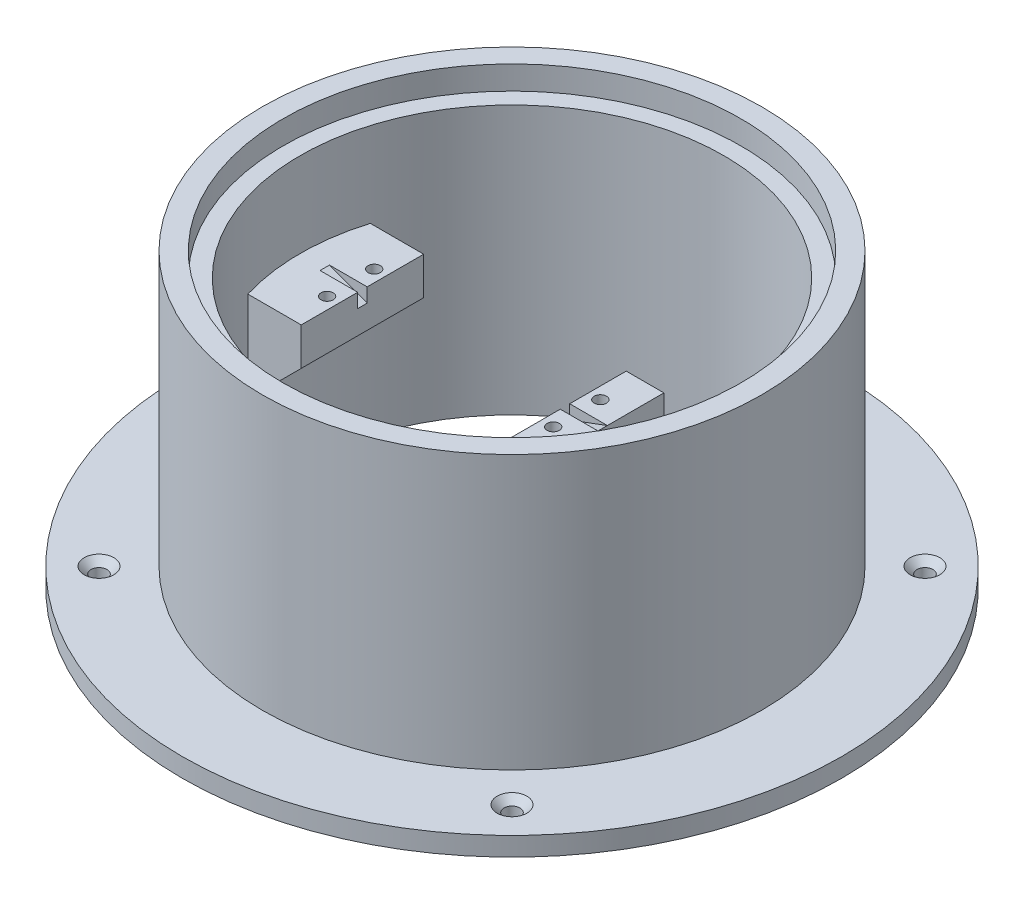
from build123d import *

# Parameters (mm, degrees)
SKETCH1_R                                           = 70
SKETCH1_R_2                                         = 45
BOSS_EXTRUDE1_DEPTH                                 = 4
SKETCH2_R                                           = 53
SKETCH2_R_2                                         = 45
BOSS_EXTRUDE2_DEPTH                                 = 53
SKETCH4_W                                           = 13.25
SKETCH4_H                                           = 8
SKETCH4_W_2                                         = 8
SKETCH4_H_2                                         = 39
BOSS_EXTRUDE4_DEPTH                                 = 13
BOSS_EXTRUDE5_DEPTH                                 = 4
SKETCH7_R                                           = 1.3
CUT_EXTRUDE4_DEPTH                                  = 7.2
SKETCH9_W                                           = 10
SKETCH9_H                                           = 25
CUT_EXTRUDE7_DEPTH                                  = 8
CUT_EXTRUDE9_DEPTH                                  = 113.289803633
CSK_FOR_M3_COUNTERSUNK_FLAT_HEAD_SCREW1_D           = 3.4
CSK_FOR_M3_COUNTERSUNK_FLAT_HEAD_SCREW1_CSINK_D     = 6.3
CSK_FOR_M3_COUNTERSUNK_FLAT_HEAD_SCREW1_CSINK_ANGLE = 90
SKETCH18_R                                          = 53
SKETCH18_R_2                                        = 48.6
BOSS_EXTRUDE6_DEPTH                                 = 5
CUT_EXTRUDE10_DEPTH                                 = 1


with BuildPart() as part:
    # Sketch1 → Boss-Extrude1 (new body)
    with BuildSketch(Plane(origin=(0, 0, 0), x_dir=(1, 0, 0), z_dir=(0, 1, 0))):
        with Locations(Location((0, 0, 0), (0, 0, 270))):
            Circle(SKETCH1_R)
        with Locations(Location((0, 0, 0), (0, 0, 270))):
            Circle(SKETCH1_R_2, mode=Mode.SUBTRACT)
    extrude(amount=BOSS_EXTRUDE1_DEPTH)

    # Sketch2 → Boss-Extrude2 (add)
    with BuildSketch(Plane(origin=(0, 4, 0), x_dir=(1, 0, 0), z_dir=(0, 1, 0))):
        with Locations(Location((0, 0, 0), (0, 0, 270))):
            Circle(SKETCH2_R)
        with Locations(Location((0, 0, 0), (0, 0, 270))):
            Circle(SKETCH2_R_2, mode=Mode.SUBTRACT)
    extrude(amount=BOSS_EXTRUDE2_DEPTH)

    # Sketch4 → Boss-Extrude4 (add, symmetric)
    with BuildSketch(Plane.XY):
        with Locations((-38.375, 35)):
            Rectangle(SKETCH4_W, SKETCH4_H)
        Polygon((-31.75, 31), (-45, 31), (-45, 17.75), align=None)
        with Locations((15.25, 19.5)):
            Rectangle(SKETCH4_W_2, SKETCH4_H_2)
    extrude(amount=BOSS_EXTRUDE4_DEPTH, both=True)


with BuildPart() as boss_extrude4_piece_1:
    # of the separate pieces the step leaves, piece 1, a body of its own (boss_extrude4_pieces)
    add(part.part.solids().sort_by_distance((0, 0, 70))[0])



with BuildPart() as boss_extrude4_piece_2:
    # of the separate pieces the step leaves, piece 2, a body of its own (boss_extrude4_pieces)
    add(part.part.solids().sort_by_distance((11.25, 39, -13))[0])


with BuildPart() as boss_extrude4_piece_1_1:
    add(boss_extrude4_piece_1.part)

    add(boss_extrude4_piece_2.part)  # Boss-Extrude5 merges Boss-Extrude4 piece 2
    # Sketch5 → Boss-Extrude5 (add)
    with BuildSketch(Plane.XZ):
        with BuildLine():
            Line((11.25, 13), (29.067400866, 34.352382842))
            ThreePointArc((29.067400866, 34.352382842), (45, 0), (29.067400866, -34.352382842))
            Line((29.067400866, -34.352382842), (11.25, -13))
            Line((11.25, -13), (11.25, 13))
        make_face()
    extrude(amount=-BOSS_EXTRUDE5_DEPTH)

    # Sketch7 → Cut-Extrude4 (cut)
    with BuildSketch(Plane(origin=(0, 39, 0), x_dir=(1, 0, 0), z_dir=(0, 1, 0))):
        with Locations(Location((-34.25, 5, 0), (0, 0, 180))):
            Circle(SKETCH7_R)
        with Locations(Location((-34.25, -5, 0), (0, 0, 180))):
            Circle(SKETCH7_R)
        with Locations(Location((13.75, 5, 0), (0, 0, 180))):
            Circle(SKETCH7_R)
        with Locations(Location((13.75, -5, 0), (0, 0, 180))):
            Circle(SKETCH7_R)
    extrude(amount=-CUT_EXTRUDE4_DEPTH, mode=Mode.SUBTRACT)

    # Sketch9 → Cut-Extrude7 (cut)
    with BuildSketch(Plane.ZY.offset(-11.25)):
        with Locations((0, 17.5)):
            Rectangle(SKETCH9_W, SKETCH9_H)
    extrude(amount=-CUT_EXTRUDE7_DEPTH, mode=Mode.SUBTRACT)

    # Sketch12 → Cut-Extrude9 (cut, through all)
    with BuildSketch(Plane(origin=(0, 4, 0), x_dir=(1, 0, 0), z_dir=(0, 1, 0))):
        with BuildLine():
            Line((29.479537487, 22.359715328), (27.25, 19.687836398))
            Line((27.25, 19.687836398), (27.25, -19.687836398))
            Line((27.25, -19.687836398), (29.479537487, -22.359715328))
            ThreePointArc((29.479537487, -22.359715328), (37, 0), (29.479537487, 22.359715328))
        make_face()
        Polygon((27.25, -19.687836398), (27.25, 19.687836398), (24.25, 16.092634774), (24.25, -16.092634774), align=None)
    extrude(amount=-CUT_EXTRUDE9_DEPTH, mode=Mode.SUBTRACT)

    # CSK for M3 Countersunk Flat Head Screw1 (through all)
    with Locations(Plane(origin=(0, 4, 0), x_dir=(1, 0, 0), z_dir=(0, 1, 0))):
        with Locations((-43.840620434, 43.840620434), (-43.840620434, -43.840620434), (43.840620434, -43.840620434), (43.840620434, 43.840620434)):
            CounterSinkHole(CSK_FOR_M3_COUNTERSUNK_FLAT_HEAD_SCREW1_D / 2, CSK_FOR_M3_COUNTERSUNK_FLAT_HEAD_SCREW1_CSINK_D / 2, counter_sink_angle=CSK_FOR_M3_COUNTERSUNK_FLAT_HEAD_SCREW1_CSINK_ANGLE)

    # Sketch18 → Boss-Extrude6 (add)
    with BuildSketch(Plane(origin=(0, 57, 0), x_dir=(1, 0, 0), z_dir=(0, 1, 0))):
        with Locations(Location((0, 0, 0), (0, 0, 270))):
            Circle(SKETCH18_R)
        with Locations(Location((0, 0, 0), (0, 0, 270))):
            Circle(SKETCH18_R_2, mode=Mode.SUBTRACT)
    extrude(amount=BOSS_EXTRUDE6_DEPTH)

    # Sketch19 → Cut-Extrude10 (cut, symmetric)
    with BuildSketch(Plane.XY):
        Polygon((-39.75, 39), (-31.75, 36), (-31.75, 39), align=None)
        Polygon((11.25, 39), (19.25, 39), (11.25, 36), align=None)
    extrude(amount=CUT_EXTRUDE10_DEPTH, both=True, mode=Mode.SUBTRACT)


solid = boss_extrude4_piece_1_1.part
